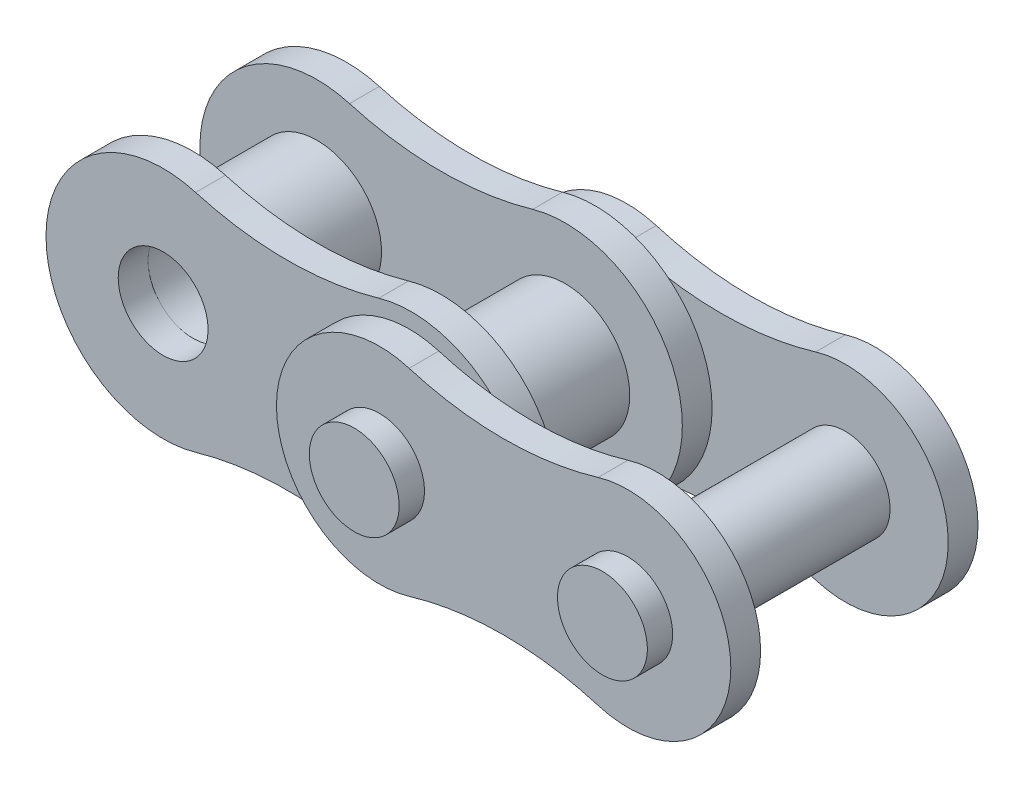
from build123d import *

# Parameters (mm, degrees)
SKETCH4_R                  = 1.651
SKETCH4_R_2                = 1.17475
BOSS_EXTRUDE1_DEPTH        = 1.5875
BOSS_EXTRUDE1_2_DEPTH      = 1.5875
SKETCH5_R                  = 1.14935
BOSS_EXTRUDE2_DEPTH        = 0.762
LPATTERN1_COUNT            = 2
LPATTERN1_PITCH            = 6.35
SKETCH7_R                  = 1.14935
BOSS_EXTRUDE3_DEPTH        = 0.762
BOSS_EXTRUDE4_DEPTH        = 3.81
BOSS_EXTRUDE4_DEPTH_BACK   = 3.81
SKETCH8_R                  = 1.14935
BOSS_EXTRUDE4_2_DEPTH      = 3.81
BOSS_EXTRUDE4_2_DEPTH_BACK = 3.81


with BuildPart() as part:
    # Sketch4 → Boss-Extrude1 (new, symmetric)
    with BuildSketch(Plane.XY):
        with Locations((-3.175, 0)):
            Circle(SKETCH4_R)
        with Locations((-3.175, 0)):
            Circle(SKETCH4_R_2, mode=Mode.SUBTRACT)
    extrude(amount=BOSS_EXTRUDE1_DEPTH, both=True)


with BuildPart() as body_2:
    # Sketch4 → Boss-Extrude1 2 (new, symmetric)
    with BuildSketch(Plane.XY):
        with Locations((3.175, 0)):
            Circle(SKETCH4_R)
        with Locations((3.175, 0)):
            Circle(SKETCH4_R_2, mode=Mode.SUBTRACT)
    extrude(amount=BOSS_EXTRUDE1_2_DEPTH, both=True)


with BuildPart() as body_3:
    # Sketch5 → Boss-Extrude2 (new body)
    with BuildSketch(Plane.XY.offset(1.5875)):
        with BuildLine():
            ThreePointArc((-2.342877482, 2.879371452), (-6.1722, 0), (-2.342877482, -2.879371452))
            ThreePointArc((-2.342877482, -2.879371452), (0, -2.54762), (2.342877482, -2.879371452))
            ThreePointArc((2.342877482, -2.879371452), (6.1722, 0), (2.342877482, 2.879371452))
            ThreePointArc((2.342877482, 2.879371452), (0, 2.54762), (-2.342877482, 2.879371452))
        make_face()
        with Locations(Location((-3.175, 0, 0), (0, 0, 180))):
            Circle(SKETCH5_R, mode=Mode.SUBTRACT)
        with Locations(Location((3.175, 0, 0), (0, 0, 180))):
            Circle(SKETCH5_R, mode=Mode.SUBTRACT)
    extrude(amount=BOSS_EXTRUDE2_DEPTH)


with BuildPart() as lpattern1_1:
    # LPattern1: pattern copy
    add(body_2.part.moved(Location(Vector(1, 0, 0) * (1 * LPATTERN1_PITCH))))


with BuildPart() as body_5:
    # Sketch7 → Boss-Extrude3 (new body)
    with BuildSketch(Plane.XY.offset(-2.4003)):
        with BuildLine():
            ThreePointArc((3.931045679, 2.526853989), (0.537464, 0), (3.931045679, -2.526853989))
            ThreePointArc((3.931045679, -2.526853989), (6.35, -2.17272892), (8.768954321, -2.526853989))
            ThreePointArc((8.768954321, -2.526853989), (12.162536, 0), (8.768954321, 2.526853989))
            ThreePointArc((8.768954321, 2.526853989), (6.35, 2.17272892), (3.931045679, 2.526853989))
        make_face()
        with Locations((3.175, 0)):
            Circle(SKETCH7_R, mode=Mode.SUBTRACT)
        with Locations((9.525, 0)):
            Circle(SKETCH7_R, mode=Mode.SUBTRACT)
    extrude(amount=-BOSS_EXTRUDE3_DEPTH)


with BuildPart() as body_6:
    # Mirror1: mirrored copy
    add(body_3.part.mirror(Plane.XY))


with BuildPart() as body_7:
    # Mirror1 2: mirrored copy
    add(body_5.part.mirror(Plane.XY))


with BuildPart() as body_8:
    # Sketch8 → Boss-Extrude4 (new, two sides: drawn at the far end of the back side and taken through both)
    with BuildSketch(Plane.XY.offset(-BOSS_EXTRUDE4_DEPTH_BACK)):
        with Locations((3.175, 0)):
            Circle(SKETCH8_R)
    extrude(amount=BOSS_EXTRUDE4_DEPTH + BOSS_EXTRUDE4_DEPTH_BACK)


with BuildPart() as body_9:
    # Sketch8 → Boss-Extrude4 2 (new, two sides: drawn at the far end of the back side and taken through both)
    with BuildSketch(Plane.XY.offset(-BOSS_EXTRUDE4_2_DEPTH_BACK)):
        with Locations((9.525, 0)):
            Circle(SKETCH8_R)
    extrude(amount=BOSS_EXTRUDE4_2_DEPTH + BOSS_EXTRUDE4_2_DEPTH_BACK)


with BuildPart() as part_1:
    add(part.part)

    # Combine2: union body 2, body 3, body 6
    add(body_2.part)
    add(body_3.part)
    add(body_6.part)


with BuildPart() as body_8_1:
    add(body_8.part)

    # Combine3: union body 7, body 9, body 5
    add(body_7.part)
    add(body_9.part)
    add(body_5.part)


solid = Compound([part_1.part, body_8_1.part])
